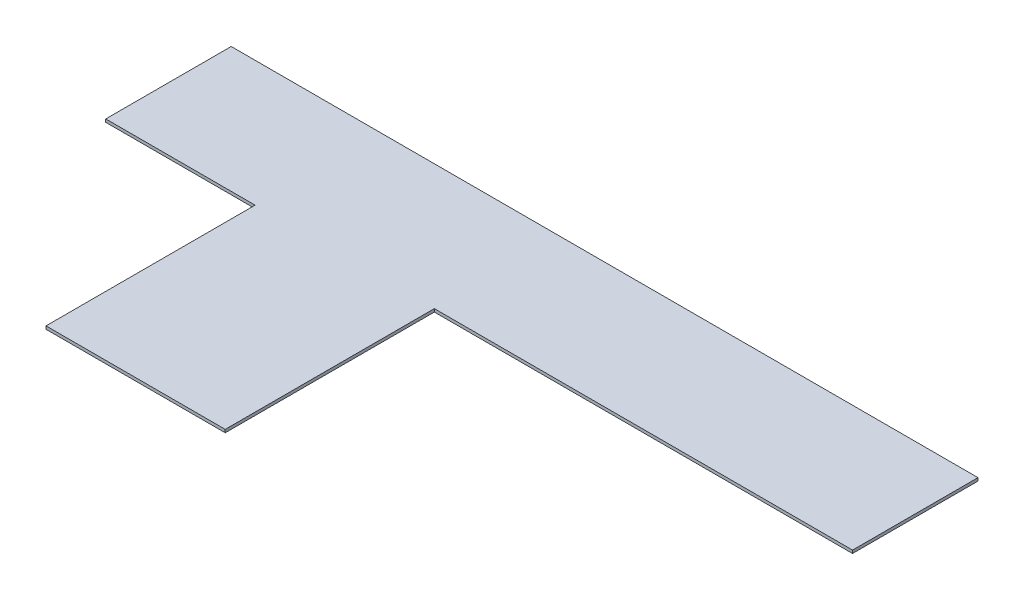
from build123d import *

# Parameters (mm, degrees)
SKETCH1_W           = 12500
SKETCH1_H           = 2100
SKETCH1_W_2         = 3000
SKETCH1_H_2         = 3500
BOSS_EXTRUDE1_DEPTH = 50
SKETCH2_W           = 750
SKETCH2_H           = 750
CUT_EXTRUDE1_DEPTH  = 10


with BuildPart() as part:
    # Sketch1 → Boss-Extrude1 (new body)
    with BuildSketch(Plane(origin=(0, 0, 0), x_dir=(1, 0, 0), z_dir=(0, 1, 0))):
        with Locations((-161.917098446, 1339.896373057)):
            Rectangle(SKETCH1_W, SKETCH1_H)
        with Locations((-2411.917098446, -1460.103626943)):
            Rectangle(SKETCH1_W_2, SKETCH1_H_2)
    extrude(amount=BOSS_EXTRUDE1_DEPTH)

    # Sketch2 → Cut-Extrude1 (cut)
    with BuildSketch(Plane.XZ):
        with Locations((-2411.917098446, 1460.103626943)):
            Rectangle(SKETCH2_W, SKETCH2_H)
        with Locations((-3286.917098446, -1339.896373057)):
            Rectangle(SKETCH2_W, SKETCH2_H)
        with Locations((-161.917098446, -1339.896373057)):
            Rectangle(SKETCH2_W, SKETCH2_H)
        with Locations((2963.082901554, -1339.896373057)):
            Rectangle(SKETCH2_W, SKETCH2_H)
    extrude(amount=-CUT_EXTRUDE1_DEPTH, mode=Mode.SUBTRACT)


solid = part.part
